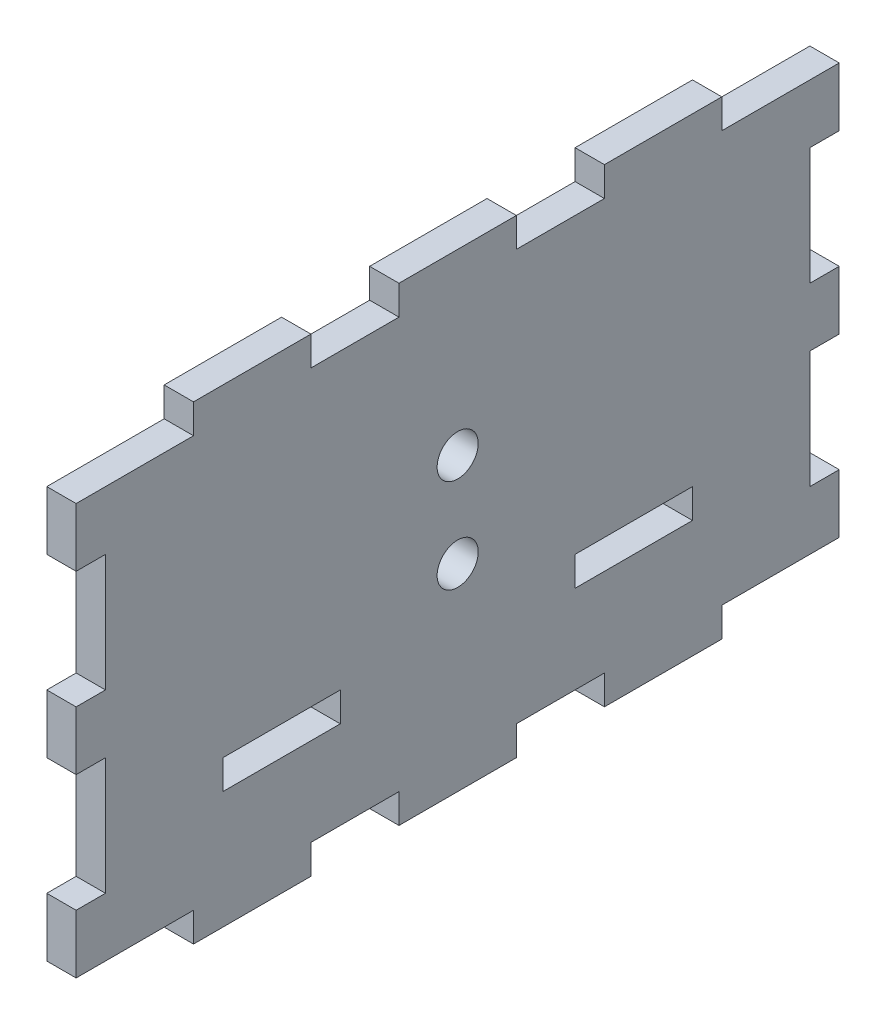
from build123d import *

# Parameters (mm, degrees)
BOSS_EXTRUDE1_DEPTH = 5
SKETCH3_W           = 20
SKETCH3_H           = 5
CUT_EXTRUDE2_DEPTH  = 5
SKETCH2_R           = 3.5
CUT_EXTRUDE3_DEPTH  = 5


with BuildPart() as part:
    # Sketch1 → Boss-Extrude1 (new body)
    with BuildSketch(Plane(origin=(0, 0, 0), x_dir=(0, 0, -1), z_dir=(1, 0, 0))):
        Polygon((65, 35), (65, 25), (60, 25), (60, 5), (65, 5), (65, -5), (60, -5), (60, -25), (65, -25), (65, -35), (60, -35), (45, -35), (45, -40), (25, -40), (25, -35), (10, -35), (10, -40), (-10, -40), (-10, -35), (-25, -35), (-25, -40), (-45, -40), (-45, -35), (-60, -35), (-65, -35), (-65, -25), (-60, -25), (-60, -5), (-65, -5), (-65, 5), (-60, 5), (-60, 25), (-65, 25), (-65, 35), (-60, 35), (-45, 35), (-45, 40), (-25, 40), (-25, 35), (-10, 35), (-10, 40), (10, 40), (10, 35), (25, 35), (25, 40), (45, 40), (45, 35), (60, 35), align=None)
    extrude(amount=BOSS_EXTRUDE1_DEPTH)

    # Sketch3 → Cut-Extrude2 (cut)
    with BuildSketch(Plane(origin=(5, 0, 0), x_dir=(0, 0, -1), z_dir=(1, 0, 0))):
        with Locations((30, -17.5)):
            Rectangle(SKETCH3_W, SKETCH3_H)
        with Locations((-30, -17.5)):
            Rectangle(SKETCH3_W, SKETCH3_H)
    extrude(amount=-CUT_EXTRUDE2_DEPTH, mode=Mode.SUBTRACT)

    # Sketch2 → Cut-Extrude3 (cut)
    with BuildSketch(Plane(origin=(0, 0, 0), x_dir=(0, 0, -1), z_dir=(1, 0, 0))):
        with Locations((0, 9.623429696)):
            Circle(SKETCH2_R)
        with Locations(Location((0, -6.376570304, 0), (0, 0, 180))):
            Circle(SKETCH2_R)
    extrude(amount=CUT_EXTRUDE3_DEPTH, mode=Mode.SUBTRACT)


solid = part.part
